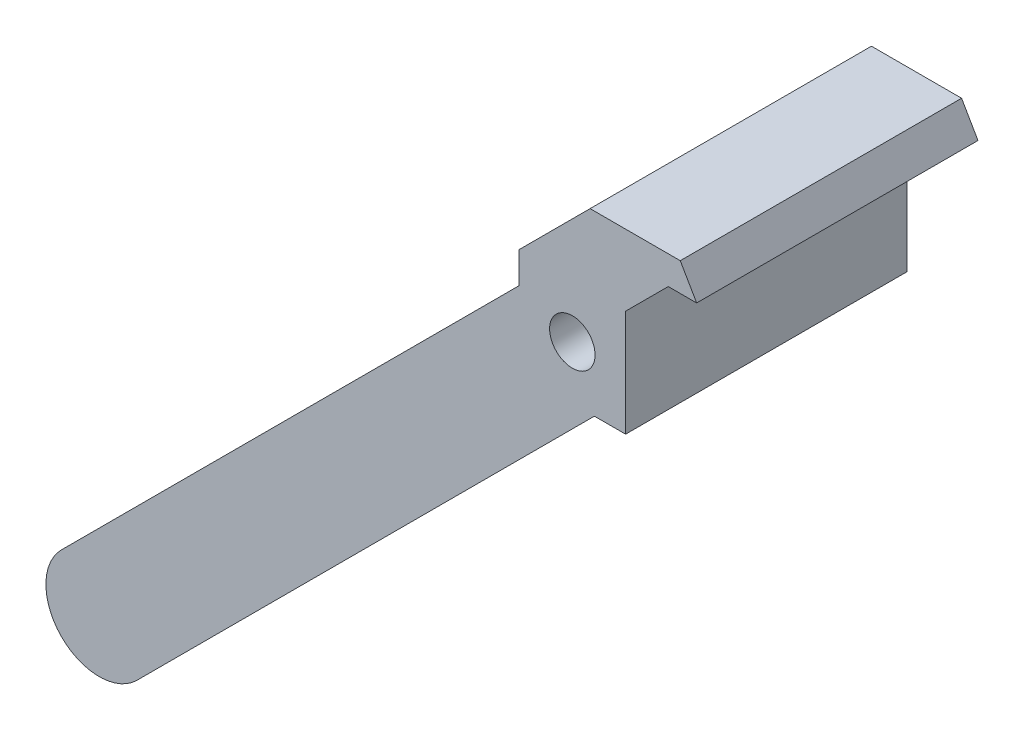
from build123d import *

# Parameters (mm, degrees)
BOSS_EXTRUDE1_DEPTH      = 9.9
BOSS_EXTRUDE1_DEPTH_BACK = 9.9
SKETCH1_W                = 7.5
SKETCH1_H                = 7.5
SKETCH1_R                = 1.6
BOSS_EXTRUDE2_DEPTH      = 19.8
BOSS_EXTRUDE3_START      = -19.8
SKETCH3_R                = 1.6
BOSS_EXTRUDE3_DEPTH      = 19.8


with BuildPart() as part:
    # Sketch1 → Boss-Extrude1 (new, two sides: drawn at the far end of the back side and taken through both)
    with BuildSketch(Plane.XY.offset(-BOSS_EXTRUDE1_DEPTH_BACK)):
        Rectangle(SKETCH1_W, SKETCH1_H)
        Circle(SKETCH1_R, mode=Mode.SUBTRACT)
    extrude(amount=BOSS_EXTRUDE1_DEPTH + BOSS_EXTRUDE1_DEPTH_BACK)

    # Sketch2 → Boss-Extrude2 (add)
    with BuildSketch(Plane.XY.offset(9.9)):
        Polygon((3.75, 3.75), (6.75, 6.75), (8.75, 6.75), (7.595299462, 8.75), (1.25, 8.75), (-3.75, 3.75), align=None)
    extrude(amount=-BOSS_EXTRUDE2_DEPTH)

    # Sketch3 → Boss-Extrude3 (add)
    with BuildSketch(Plane.XY.offset(9.9).offset(BOSS_EXTRUDE3_START)):
        with BuildLine():
            Line((2.651650429, -2.651650429), (-30.646899338, -35.950200197))
            ThreePointArc((-30.646899338, -35.950200197), (-35.950200197, -35.950200197), (-35.950200197, -30.646899338))
            Line((-35.950200197, -30.646899338), (-2.651650429, 2.651650429))
            ThreePointArc((-2.651650429, 2.651650429), (2.651650429, 2.651650429), (2.651650429, -2.651650429))
        make_face()
        Circle(SKETCH3_R, mode=Mode.SUBTRACT)
    extrude(amount=BOSS_EXTRUDE3_DEPTH)


solid = part.part
